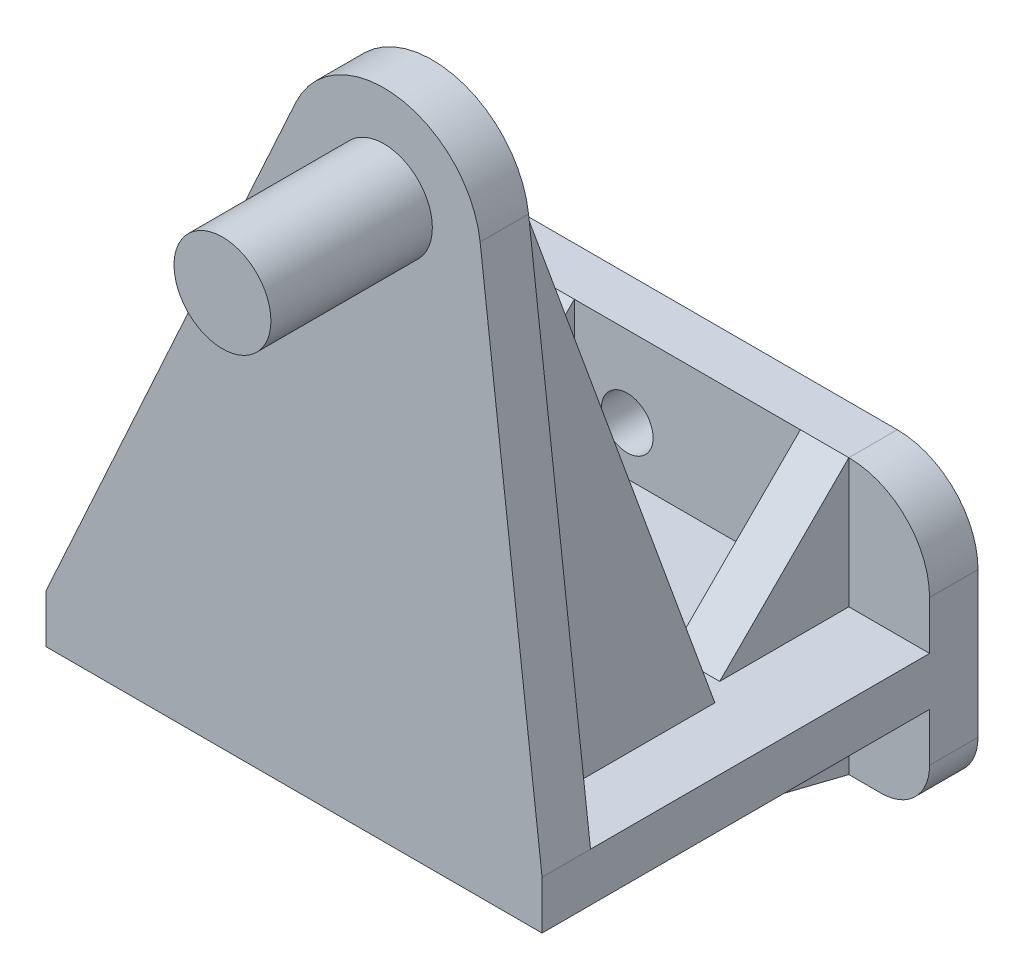
from build123d import *

# Parameters (mm, degrees)
SKETCH_1_R      = 1.6
EXTRUDE_1_DEPTH = 3
SKETCH_2_W      = 30.724754664
SKETCH_2_H      = 3
EXTRUDE_2_DEPTH = 24
SKETCH_4_R      = 3
EXTRUDE_3_DEPTH = 10
SKETCH_5_R      = 6
SKETCH_5_R_2    = 3
EXTRUDE_4_DEPTH = 3
EXTRUDE_START   = -4
EXTRUDE_5_DEPTH = 3
EXTRUDE_START_2 = -18
EXTRUDE_6_DEPTH = 3
EXTRUDE_START_3 = -5
EXTRUDE_7_DEPTH = 3
EXTRUDE_START_4 = -22
EXTRUDE_8_DEPTH = 3


with BuildPart() as part:
    # 草图1 → 凸台-拉伸1 (new body)
    with BuildSketch(Plane.XY):
        with BuildLine():
            ThreePointArc((-10, 5), (-13.535533906, 3.535533906), (-15, 0))
            Line((-15, 0), (-15, -9))
            ThreePointArc((-15, -9), (-14.121320344, -11.121320344), (-12, -12))
            Line((-12, -12), (15.724754664, -12))
            ThreePointArc((15.724754664, -12), (17.846075007, -11.121320344), (18.724754664, -9))
            Line((18.724754664, -9), (18.724754664, 0))
            ThreePointArc((18.724754664, 0), (17.26028857, 3.535533906), (13.724754664, 5))
            Line((13.724754664, 5), (-10, 5))
        make_face()
        with Locations((-10, 0)):
            Circle(SKETCH_1_R, mode=Mode.SUBTRACT)
        Circle(SKETCH_1_R, mode=Mode.SUBTRACT)
    extrude(amount=EXTRUDE_1_DEPTH)

    # 草图2 → 凸台-拉伸2 (add)
    with BuildSketch(Plane.XY.offset(3)):
        with Locations((3.362377332, -4.5)):
            Rectangle(SKETCH_2_W, SKETCH_2_H)
    extrude(amount=EXTRUDE_2_DEPTH)

    # 草图5 → 凸台-拉伸4 (add)
    # profile 1 of 3: a face of its own
    with BuildSketch(Plane(origin=(0, 0, 27), x_dir=(-1, 0, 0), z_dir=(0, 0, -1))):
        with BuildLine():
            Line((12, -3), (-3.470735188, 30.929262484))
            ThreePointArc((-3.470735188, 30.929262484), (-3.066741995, 29.713658339), (-2.93, 28.44))
            ThreePointArc((-2.93, 28.44), (-9.28613724, 22.450578804), (-14.887722089, 29.151018645))
            Line((-14.887722089, 29.151018645), (-18.724754664, -3))
            Line((-18.724754664, -3), (12, -3))
        make_face()
    # profile 2 of 3: a face of its own
    with BuildSketch(Plane(origin=(0, 0, 27), x_dir=(-1, 0, 0), z_dir=(0, 0, -1))):
        with Locations((-8.93, 28.44)):
            Circle(SKETCH_5_R)
        with Locations(Location((-8.93, 28.44, 0), (0, 0, 180))):
            Circle(SKETCH_5_R_2, mode=Mode.SUBTRACT)
    # profile 3 of 3: a face of its own
    with BuildSketch(Plane(origin=(0, 0, 27), x_dir=(-1, 0, 0), z_dir=(0, 0, -1))):
        with Locations(Location((-8.93, 28.44, 0), (0, 0, 180))):
            Circle(SKETCH_5_R_2)
    extrude(amount=EXTRUDE_4_DEPTH)

    # 草图6 → 凸台-拉伸5 (add)
    with BuildSketch(Plane(origin=(18.724754664, 0, 0), x_dir=(0, 0, -1), z_dir=(1, 0, 0)).offset(EXTRUDE_START)):
        Polygon((-24, 29.151018645), (-12.297986212, -3), (-24, -3), align=None)
    extrude(amount=-EXTRUDE_5_DEPTH)

    # 草图7 → 凸台-拉伸6 (add)
    with BuildSketch(Plane(origin=(18.724754664, 0, 0), x_dir=(0, 0, -1), z_dir=(1, 0, 0)).offset(EXTRUDE_START_2)):
        Polygon((-15.989522991, -3), (-24, 19.008604701), (-24, -3), align=None)
    extrude(amount=EXTRUDE_6_DEPTH)

    # 草图8 → 凸台-拉伸7 (add)
    with BuildSketch(Plane(origin=(18.724754664, 0, 0), x_dir=(0, 0, -1), z_dir=(1, 0, 0)).offset(EXTRUDE_START_3)):
        Polygon((-3, 5), (-11, -3), (-3, -3), align=None)
        Polygon((-3, -12), (-27, -6), (-3, -6), align=None)
    extrude(amount=-EXTRUDE_7_DEPTH)

    # 草图9 → 凸台-拉伸8 (add)
    with BuildSketch(Plane(origin=(18.724754664, 0, 0), x_dir=(0, 0, -1), z_dir=(1, 0, 0)).offset(EXTRUDE_START_4)):
        Polygon((-27, -6), (-3, -12), (-3, -6), align=None)
        Polygon((-3, 5), (-11, -3), (-3, -3), align=None)
    extrude(amount=-EXTRUDE_8_DEPTH)


with BuildPart() as body_2:
    # 草图4 → 凸台-拉伸3 (new body)
    with BuildSketch(Plane.XY.offset(27)):
        with Locations((8.93, 28.44)):
            Circle(SKETCH_4_R)
    extrude(amount=EXTRUDE_3_DEPTH)


solid = Compound([part.part, body_2.part])
